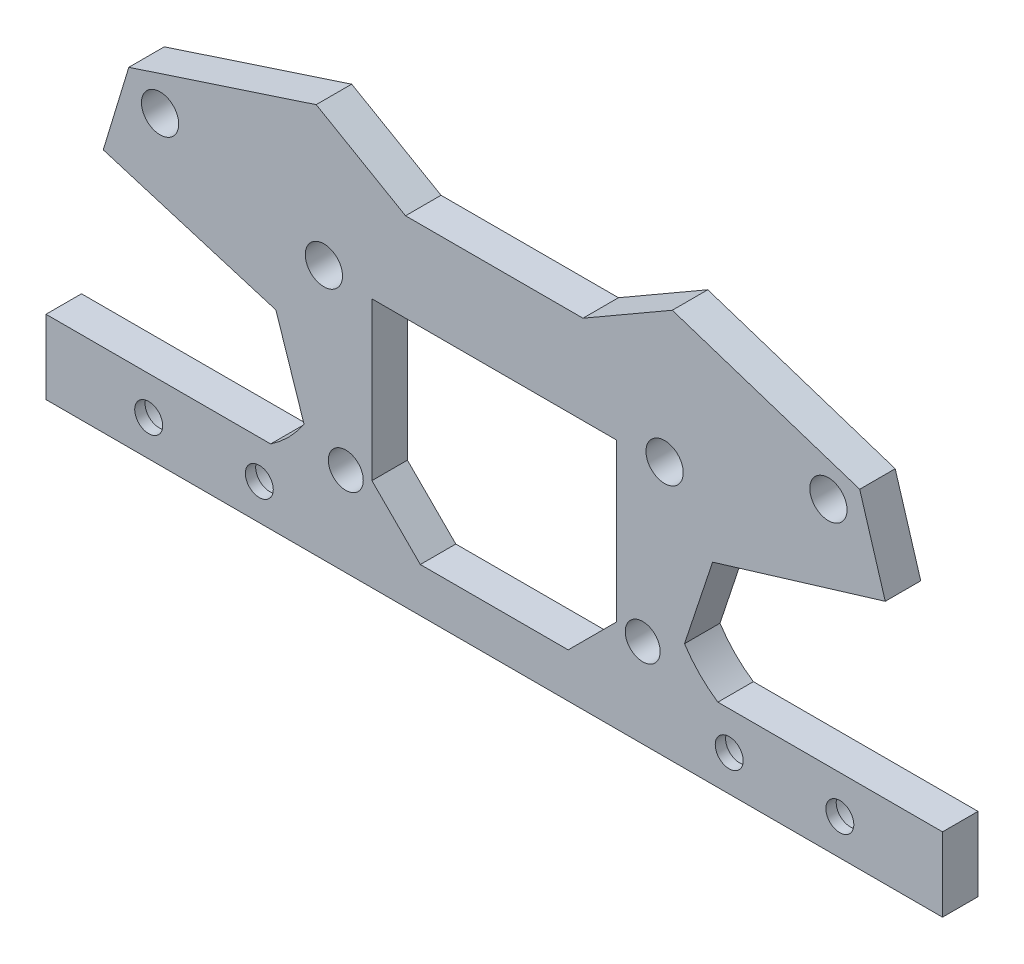
from build123d import *

# Parameters (mm, degrees)
SKETCH1_R           = 1.5
SKETCH1_R_2         = 1.6
BOSS_EXTRUDE1_DEPTH = 3.048
SKETCH2_R           = 2
CUT_EXTRUDE1_DEPTH  = 2.159
BOSS_EXTRUDE2_DEPTH = 3.048


with BuildPart() as part:
    # Sketch1 → Boss-Extrude1 (new body)
    with BuildSketch(Plane.XY):
        with BuildLine():
            Line((79.265356566, -204.430419713), (63.170457618, -199.16202177))
            Line((63.170457618, -199.16202177), (55.498201994, -203.59160062))
            Line((55.498201994, -203.59160062), (47.878201994, -203.59160062))
            Line((47.878201994, -203.59160062), (47.878201994, -211.21160062))
            Line((47.878201994, -211.21160062), (58.386201994, -211.21160062))
            Line((58.386201994, -211.21160062), (58.386201994, -232.70660062))
            Line((58.386201994, -232.70660062), (86.378201994, -232.70660062))
            Line((86.378201994, -232.70660062), (86.378201994, -226.35660062))
            Line((86.378201994, -226.35660062), (67.083766093, -226.35660062))
            ThreePointArc((67.083766093, -226.35660062), (65.503026614, -225.045162417), (64.21834769, -223.442599621))
            Line((64.21834769, -223.442599621), (66.631816904, -216.167059283))
            Line((66.631816904, -216.167059283), (81.461052688, -211.668659788))
            Line((81.461052688, -211.668659788), (79.265356566, -204.430419713))
        make_face()
        with BuildLine():
            add(Edge.make_bspline(
                [(69.258201994, -229.63160062), (69.258201994, -227.23160062), (66.858201994, -227.23160062), (66.858201994, -229.63160062), (66.858201994, -232.03160062), (69.258201994, -232.03160062), (69.258201994, -229.63160062)],
                knots=[0, 0, 0, 0, 0.5, 0.5, 0.5, 1, 1, 1, 1], degree=3, weights=[1, 0.333333333, 0.333333333, 1, 0.333333333, 0.333333333, 1]))
        make_face(mode=Mode.SUBTRACT)
        with Locations(Location((60.628201973, -225.081600518, 0), (0, 0, 180))):
            Circle(SKETCH1_R, mode=Mode.SUBTRACT)
        with BuildLine():
            add(Edge.make_bspline(
                [(78.758201994, -229.63160062), (78.758201994, -227.23160062), (76.358201994, -227.23160062), (76.358201994, -229.63160062), (76.358201994, -232.03160062), (78.758201994, -232.03160062), (78.758201994, -229.63160062)],
                knots=[0, 0, 0, 0, 0.5, 0.5, 0.5, 1, 1, 1, 1], degree=3, weights=[1, 0.333333333, 0.333333333, 1, 0.333333333, 0.333333333, 1]))
        make_face(mode=Mode.SUBTRACT)
        with Locations(Location((62.509976145, -210.781673598, 0), (0, 0, 180))):
            Circle(SKETCH1_R_2, mode=Mode.SUBTRACT)
        with Locations(Location((76.579459421, -206.513742506, 0), (0, 0, 180))):
            Circle(SKETCH1_R_2, mode=Mode.SUBTRACT)
    extrude(amount=BOSS_EXTRUDE1_DEPTH)

    # Sketch2 → Cut-Extrude1 (cut)
    with BuildSketch(Plane(origin=(0, 0, 0), x_dir=(-1, 0, 0), z_dir=(0, 0, -1))):
        with Locations((-77.558201994, -229.63160062)):
            Circle(SKETCH2_R)
        with Locations((-68.058201994, -229.63160062)):
            Circle(SKETCH2_R)
    extrude(amount=-CUT_EXTRUDE1_DEPTH, mode=Mode.SUBTRACT)

    # Mirror1: part across plane


with BuildPart() as part_1:
    add(part.part)
    add(part.part.mirror(Plane(origin=(47.878201994, 0, 3.048), x_dir=(0, 0, 1), z_dir=(1, 0, 0))))

    # Sketch3 → Boss-Extrude2 (add)
    with BuildSketch(Plane.XY.offset(3.048)):
        Polygon((41.528201994, -228.89660062), (37.370201994, -224.73860062), (37.370201994, -232.70660062), (58.386201994, -232.70660062), (58.386201994, -224.73860062), (54.228201994, -228.89660062), align=None)
    extrude(amount=-BOSS_EXTRUDE2_DEPTH)


solid = part_1.part
